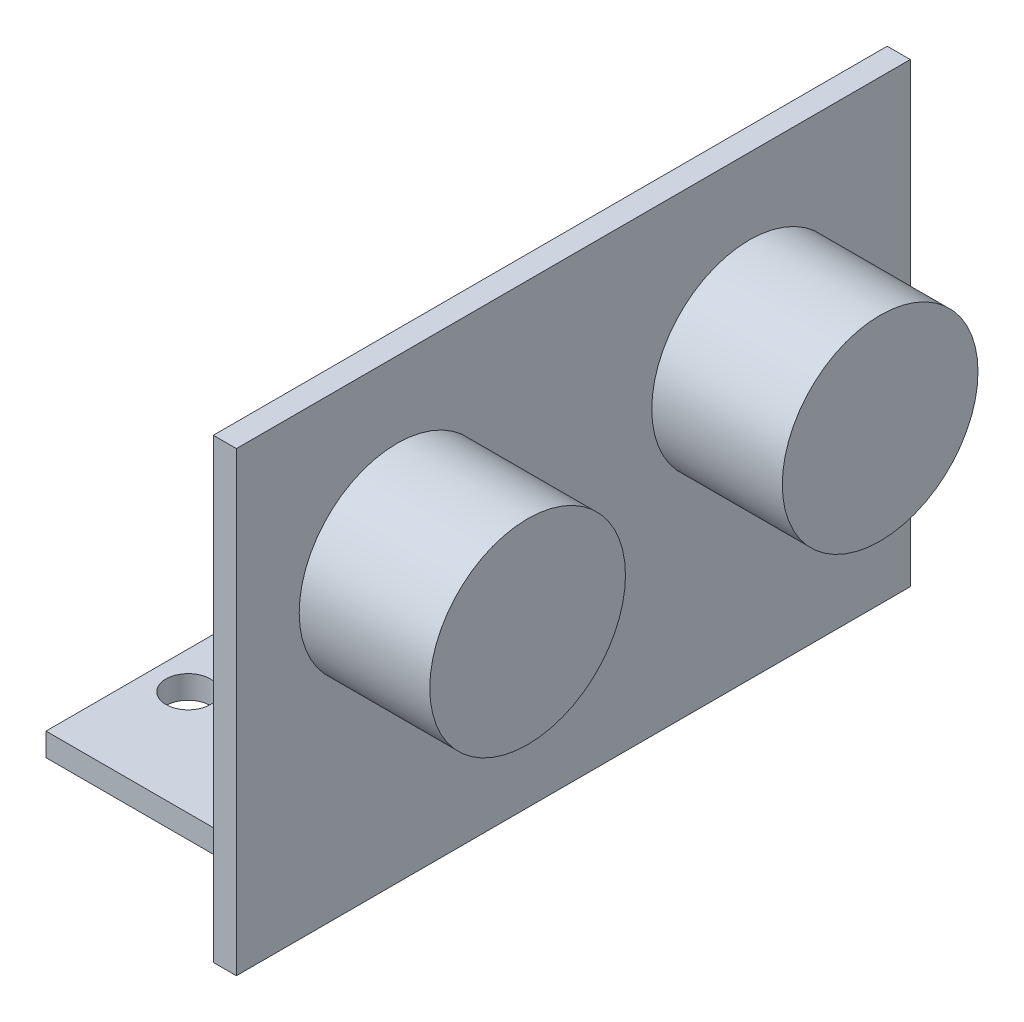
from build123d import *

# Parameters (mm, degrees)
ESQUISSE1_W          = 54.61
ESQUISSE1_H          = 37
BOSS_EXTRU_1_DEPTH   = 1.87
ESQUISSE2_R          = 7.93
BOSS_EXTRU_2_DEPTH   = 10.58
ESQUISSE3_W          = 39.43
ESQUISSE3_H          = 1.87
BOSS_EXTRU_3_DEPTH   = 21.15
D_GAGEMENT_M31_D     = 3.6
D_GAGEMENT_M31_DEPTH = 1.99
D_GAGEMENT_M31_TIP   = 1.081549114


with BuildPart() as part:
    # Esquisse1 → Boss.-Extru.1 (new body)
    with BuildSketch(Plane(origin=(0, 0, 0), x_dir=(0, 0, -1), z_dir=(1, 0, 0))):
        with Locations((27.305, 18.5)):
            Rectangle(ESQUISSE1_W, ESQUISSE1_H)
    extrude(amount=BOSS_EXTRU_1_DEPTH)

    # Esquisse2 → Boss.-Extru.2 (add)
    with BuildSketch(Plane(origin=(1.87, 0, 0), x_dir=(0, 0, -1), z_dir=(1, 0, 0))):
        with Locations((13.02, 22.93)):
            Circle(ESQUISSE2_R)
        with Locations((41.59, 22.93)):
            Circle(ESQUISSE2_R)
    extrude(amount=BOSS_EXTRU_2_DEPTH)

    # Esquisse3 → Boss.-Extru.3 (add)
    with BuildSketch(Plane.ZY):
        with Locations((-27.305, 0.935)):
            Rectangle(ESQUISSE3_W, ESQUISSE3_H)
    extrude(amount=BOSS_EXTRU_3_DEPTH)

    # Dégagement M31
    with Locations(Plane(origin=(-18.15, 1.87, -38.5), x_dir=(0, 0, 1), z_dir=(0, 1, 0))):
        with Locations((0, 0), (22.39, 0)):
            Hole(D_GAGEMENT_M31_D / 2, depth=D_GAGEMENT_M31_DEPTH)
            with Locations((0, 0, -(D_GAGEMENT_M31_DEPTH + D_GAGEMENT_M31_TIP / 2))):  # 118° drill point
                Cone(0, D_GAGEMENT_M31_D / 2, D_GAGEMENT_M31_TIP, mode=Mode.SUBTRACT)


solid = part.part
